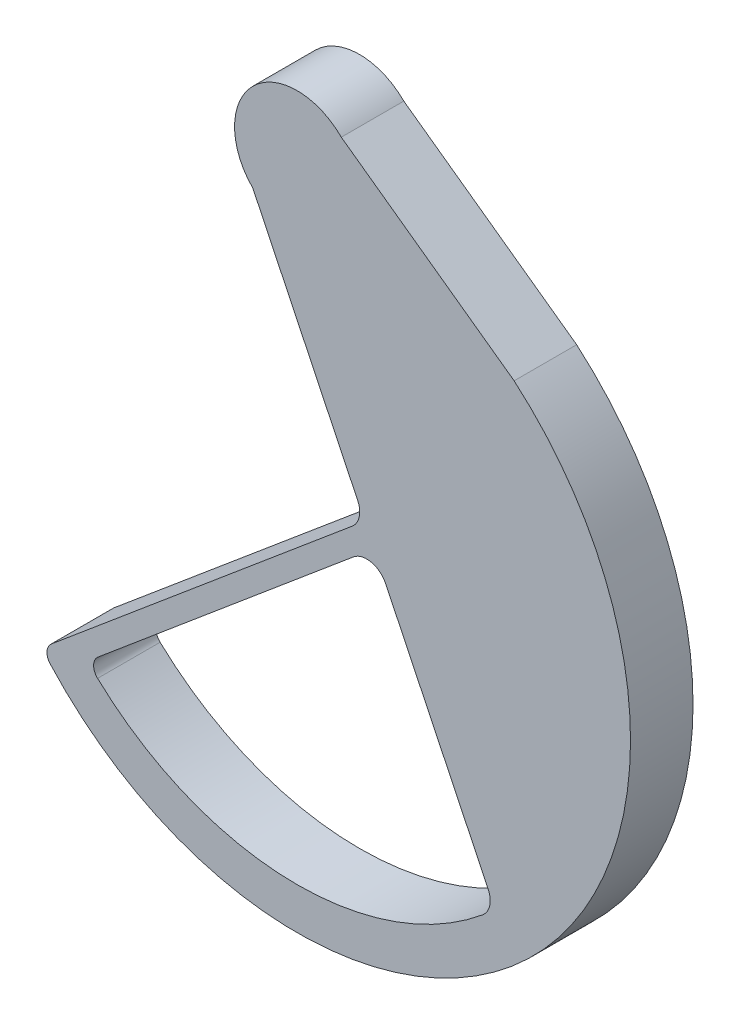
from build123d import *

# Parameters (mm, degrees)
EXTRUDE_1_DEPTH     = 15
SKETCH_9_R          = 10.1
CUT_EXTRUDE_3_DEPTH = 2


with BuildPart() as part:
    # ｽｹｯﾁ4 → ﾎﾞｽ - 押し出し1 (new body)
    with BuildSketch(Plane.XY):
        with BuildLine():
            Line((-53.623111018, -124.995132678), (-58.940636287, -129.45706617))
            ThreePointArc((-58.940636287, -129.45706617), (-60.005384698, -131.552012131), (-59.233530865, -133.771635843))
            ThreePointArc((-59.233530865, -133.771635843), (57.362306223, -135.763481103), (52.076178918, -19.270504783))
            Line((52.076178918, -19.270504783), (10.606601718, 10.606601718))
            ThreePointArc((10.606601718, 10.606601718), (-10.606601718, 10.606601718), (-10.606601718, -10.606601718))
            Line((-10.606601718, -10.606601718), (14.536280154, -62.889638219))
            ThreePointArc((14.536280154, -62.889638219), (14.918089499, -66.109676181), (13.244185189, -68.886809092))
            Line((13.244185189, -68.886809092), (-53.623111018, -124.995132678))
        make_face()
        with BuildLine():
            Line((21.232400696, -76.813798404), (45.844843506, -127.993820346))
            ThreePointArc((45.844843506, -127.993820346), (46.221944165, -131.235480845), (44.518718993, -134.019289696))
            ThreePointArc((44.518718993, -134.019289696), (-2.231208213, -149.964431749), (-47.870174388, -131.072951785))
            ThreePointArc((-47.870174388, -131.072951785), (-48.817477846, -128.802229421), (-47.747678417, -126.586582094))
            Line((-47.747678417, -126.586582094), (13.511229465, -75.151532228))
            ThreePointArc((13.511229465, -75.151532228), (17.77869109, -74.092739753), (21.232400696, -76.813798404))
        make_face(mode=Mode.SUBTRACT)
    extrude(amount=EXTRUDE_1_DEPTH)

    # ｽｹｯﾁ9 → ｶｯﾄ - 押し出し3 (cut)
    with BuildSketch(Plane(origin=(0, 0, 0), x_dir=(-1, 0, 0), z_dir=(0, 0, -1))):
        Circle(SKETCH_9_R)
    extrude(amount=-CUT_EXTRUDE_3_DEPTH, mode=Mode.SUBTRACT)


solid = part.part
